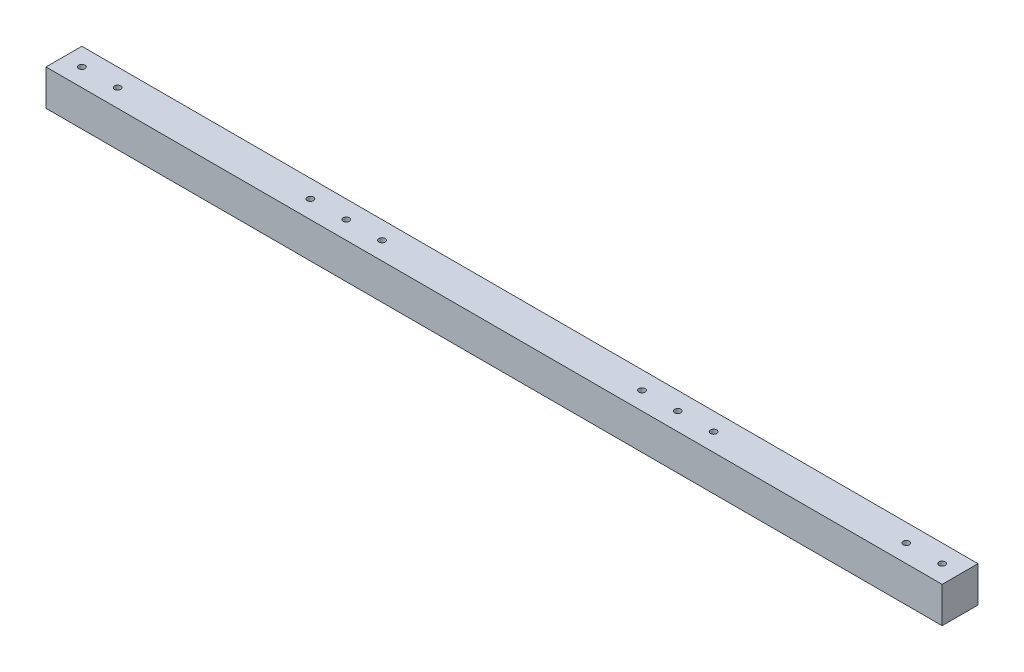
from build123d import *

# Parameters (mm, degrees)
SKETCH_1_W          = 500
SKETCH_1_H          = 20
SKETCH_1_R          = 1.75
EXTRUDE_1_DEPTH     = 20
CUT_EXTRUDE_1_REACH = 252.998
SKETCH_2_R          = 1.75


with BuildPart() as part:
    # 草图1 → 凸台-拉伸1 (new body)
    with BuildSketch(Plane(origin=(0, 0, 0), x_dir=(1, 0, 0), z_dir=(0, 1, 0))):
        Rectangle(SKETCH_1_W, SKETCH_1_H)
        with Locations(Location((240, 0, 0), (0, 0, 270))):
            Circle(SKETCH_1_R, mode=Mode.SUBTRACT)
        with Locations(Location((220, 0, 0), (0, 0, 270))):
            Circle(SKETCH_1_R, mode=Mode.SUBTRACT)
        with Locations(Location((-240, 0, 0), (0, 0, 90))):
            Circle(SKETCH_1_R, mode=Mode.SUBTRACT)
        with Locations(Location((-220, 0, 0), (0, 0, 90))):
            Circle(SKETCH_1_R, mode=Mode.SUBTRACT)
    extrude(amount=EXTRUDE_1_DEPTH)

    # 草图2 → 切除-拉伸1 (cut, up to next)
    with BuildSketch(Plane.XZ, mode=Mode.PRIVATE) as cut_extrude_1_sk1:
        with Locations(Location((-92.5, 0, 0), (0, 0, 270))):
            Circle(SKETCH_2_R)
    cut_extrude_1_tool1 = extrude(cut_extrude_1_sk1.sketch, amount=-CUT_EXTRUDE_1_REACH, mode=Mode.PRIVATE) & part.part
    # 草图2 → 切除-拉伸1 (cut, up to next)
    with BuildSketch(Plane.XZ, mode=Mode.PRIVATE) as cut_extrude_1_sk2:
        with Locations(Location((-72.5, 0, 0), (0, 0, 270))):
            Circle(SKETCH_2_R)
    cut_extrude_1_tool2 = extrude(cut_extrude_1_sk2.sketch, amount=-CUT_EXTRUDE_1_REACH, mode=Mode.PRIVATE) & part.part
    # 草图2 → 切除-拉伸1 (cut, up to next)
    with BuildSketch(Plane.XZ, mode=Mode.PRIVATE) as cut_extrude_1_sk3:
        with Locations(Location((-112.5, 0, 0), (0, 0, 270))):
            Circle(SKETCH_2_R)
    cut_extrude_1_tool3 = extrude(cut_extrude_1_sk3.sketch, amount=-CUT_EXTRUDE_1_REACH, mode=Mode.PRIVATE) & part.part
    # 草图2 → 切除-拉伸1 (cut, up to next)
    with BuildSketch(Plane.XZ, mode=Mode.PRIVATE) as cut_extrude_1_sk4:
        with Locations(Location((112.5, 0, 0), (0, 0, 90))):
            Circle(SKETCH_2_R)
    cut_extrude_1_tool4 = extrude(cut_extrude_1_sk4.sketch, amount=-CUT_EXTRUDE_1_REACH, mode=Mode.PRIVATE) & part.part
    # 草图2 → 切除-拉伸1 (cut, up to next)
    with BuildSketch(Plane.XZ, mode=Mode.PRIVATE) as cut_extrude_1_sk5:
        with Locations(Location((92.5, 0, 0), (0, 0, 90))):
            Circle(SKETCH_2_R)
    cut_extrude_1_tool5 = extrude(cut_extrude_1_sk5.sketch, amount=-CUT_EXTRUDE_1_REACH, mode=Mode.PRIVATE) & part.part
    # 草图2 → 切除-拉伸1 (cut, up to next)
    with BuildSketch(Plane.XZ, mode=Mode.PRIVATE) as cut_extrude_1_sk6:
        with Locations(Location((72.5, 0, 0), (0, 0, 90))):
            Circle(SKETCH_2_R)
    cut_extrude_1_tool6 = extrude(cut_extrude_1_sk6.sketch, amount=-CUT_EXTRUDE_1_REACH, mode=Mode.PRIVATE) & part.part
    add(cut_extrude_1_tool1.solids().sort_by_distance((-92.5, 0, 0))[0], mode=Mode.SUBTRACT)
    add(cut_extrude_1_tool2.solids().sort_by_distance((-72.5, 0, 0))[0], mode=Mode.SUBTRACT)
    add(cut_extrude_1_tool3.solids().sort_by_distance((-112.5, 0, 0))[0], mode=Mode.SUBTRACT)
    add(cut_extrude_1_tool4.solids().sort_by_distance((112.5, 0, 0))[0], mode=Mode.SUBTRACT)
    add(cut_extrude_1_tool5.solids().sort_by_distance((92.5, 0, 0))[0], mode=Mode.SUBTRACT)
    add(cut_extrude_1_tool6.solids().sort_by_distance((72.5, 0, 0))[0], mode=Mode.SUBTRACT)


solid = part.part
